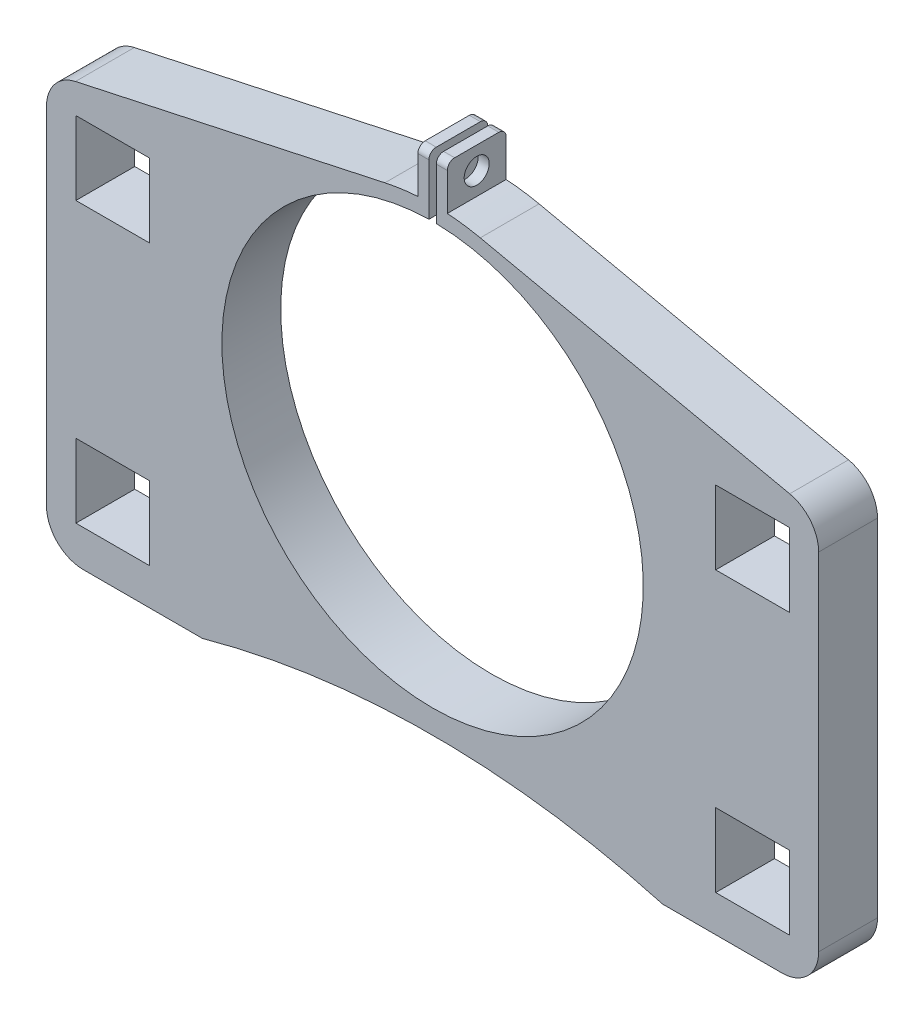
from build123d import *

# Parameters (mm, degrees)
SKIZZE1_R                       = 30.65
SKIZZE1_R_2                     = 28.65
AUFSATZ_LINEAR_AUSTRAGEN1_DEPTH = 8
AUFSATZ_LINEAR_AUSTRAGEN2_DEPTH = 8
SKIZZE3_W                       = 1
SKIZZE3_H                       = 2.855309686
SCHNITT_LINEAR_AUSTRAGEN1_DEPTH = 10
AUFSATZ_LINEAR_AUSTRAGEN3_DEPTH = 8
SKIZZE5_R                       = 1.7
SCHNITT_LINEAR_AUSTRAGEN2_DEPTH = 8
VERRUNDUNG2_R                   = 1
SKIZZE7_W                       = 10
SKIZZE7_H                       = 10
SCHNITT_LINEAR_AUSTRAGEN4_DEPTH = 10
VERRUNDUNG3_R                   = 5


with BuildPart() as part:
    # Skizze1 → Aufsatz-Linear austragen1 (new body)
    with BuildSketch(Plane.XY):
        Circle(SKIZZE1_R)
        Circle(SKIZZE1_R_2, mode=Mode.SUBTRACT)
    extrude(amount=AUFSATZ_LINEAR_AUSTRAGEN1_DEPTH)

    # Skizze2 → Aufsatz-Linear austragen2 (add)
    with BuildSketch(Plane.XY.offset(8)):
        with BuildLine():
            Line((52.5, -36.106090228), (52.5, 20))
            Line((52.5, 20), (6.481641536, 29.956815969))
            Line((6.481641536, 29.956815969), (6.460494255, 29.859077581))
            ThreePointArc((6.460494255, 29.859077581), (26.986544825, -14.318830203), (-21.103143411, -22.089812995))
            ThreePointArc((-21.103143411, -22.089812995), (-29.404257147, 8.288073457), (-6.460494255, 29.859077581))
            Line((-6.460494255, 29.859077581), (-6.481641536, 29.956815969))
            Line((-6.481641536, 29.956815969), (-52.5, 20))
            Line((-52.5, 20), (-52.5, -36.106090228))
            Line((-52.5, -36.106090228), (-31.288777705, -36.106090228))
            ThreePointArc((-31.288777705, -36.106090228), (0, -31.845839174), (31.288777705, -36.106090228))
            Line((31.288777705, -36.106090228), (52.5, -36.106090228))
        make_face()
    extrude(amount=-AUFSATZ_LINEAR_AUSTRAGEN2_DEPTH)

    # Skizze3 → Schnitt-Linear austragen1 (cut)
    with BuildSketch(Plane.XY.offset(8)):
        with Locations((0, 29.34103969)):
            Rectangle(SKIZZE3_W, SKIZZE3_H)
    extrude(amount=-SCHNITT_LINEAR_AUSTRAGEN1_DEPTH, mode=Mode.SUBTRACT)

    # Skizze4 → Aufsatz-Linear austragen3 (add)
    with BuildSketch(Plane.XY.offset(8)):
        Polygon((0.5, 30.645921425), (0.5, 36.645921425), (2, 36.645921425), (2, 29.02715443), align=None)
        Polygon((-2, 29.02715443), (-0.5, 30.645921425), (-0.5, 36.645921425), (-2, 36.645921425), align=None)
    extrude(amount=-AUFSATZ_LINEAR_AUSTRAGEN3_DEPTH)

    # Skizze5 → Schnitt-Linear austragen2 (cut)
    with BuildSketch(Plane.ZY.offset(2)):
        with Locations(Location((4, 33.615299481, 0), (0, 0, 270))):
            Circle(SKIZZE5_R)
    extrude(amount=-SCHNITT_LINEAR_AUSTRAGEN2_DEPTH, mode=Mode.SUBTRACT)

    # Verrundung2
    verrundung2_edges = [part.edges().sort_by_distance(p)[0] for p in [
        (1.25, 36.645921425, 8),
        (1.25, 36.645921425, 0),
        (-1.25, 36.645921425, 8),
        (-1.25, 36.645921425, 0),
    ]]
    fillet(verrundung2_edges, radius=VERRUNDUNG2_R)

    # Skizze7 → Schnitt-Linear austragen4 (cut)
    with BuildSketch(Plane(origin=(0, 0, 0), x_dir=(-1, 0, 0), z_dir=(0, 0, -1))):
        with Locations((-43.5, 11.86546468)):
            Rectangle(SKIZZE7_W, SKIZZE7_H)
        with Locations((-43.5, -26.13453532)):
            Rectangle(SKIZZE7_W, SKIZZE7_H)
        with Locations((43.5, -26.13453532)):
            Rectangle(SKIZZE7_W, SKIZZE7_H)
        with Locations((43.5, 11.86546468)):
            Rectangle(SKIZZE7_W, SKIZZE7_H)
    extrude(amount=-SCHNITT_LINEAR_AUSTRAGEN4_DEPTH, mode=Mode.SUBTRACT)

    # Verrundung3
    verrundung3_edges = [part.edges().sort_by_distance(p)[0] for p in [
        (52.5, 20, 4),
        (52.5, -36.106090228, 4),
        (-52.5, -36.106090228, 4),
        (-52.5, 20, 4),
    ]]
    fillet(verrundung3_edges, radius=VERRUNDUNG3_R)


solid = part.part
